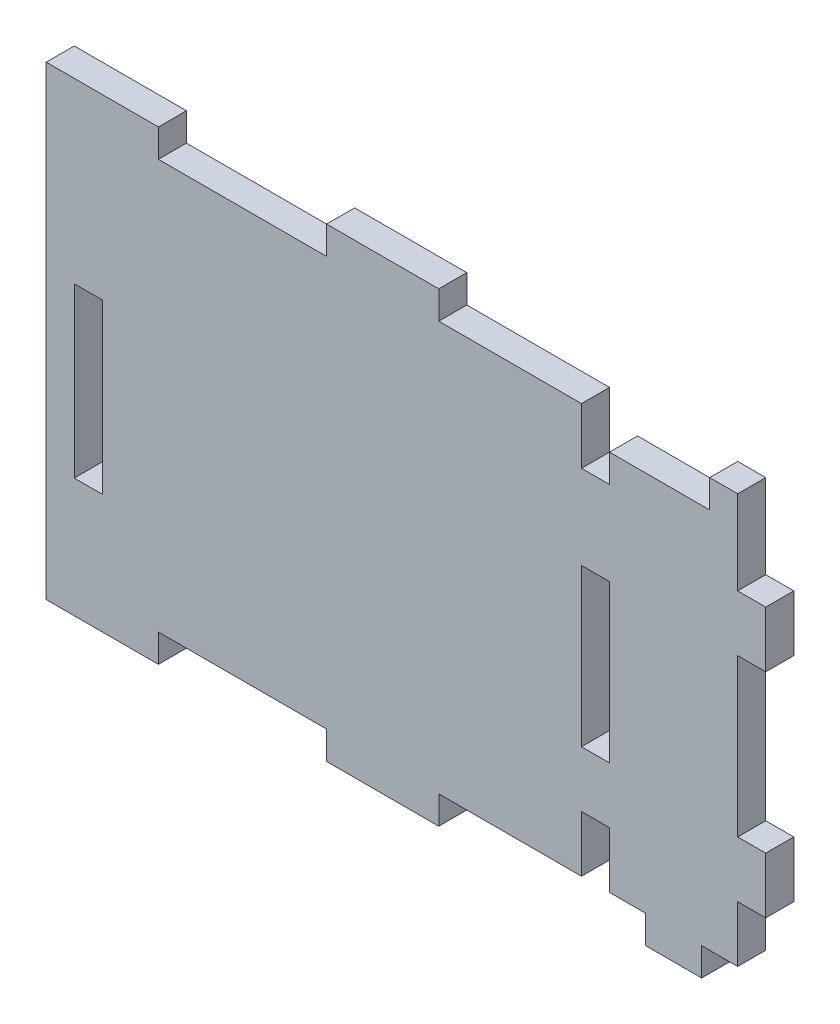
from build123d import *

# Parameters (mm, degrees)
ESQUISSE1_W             = 128.311788567
ESQUISSE1_H             = 73
BOSS_EXTRU_1_DEPTH      = 5
ESQUISSE3_W             = 5
ESQUISSE3_H             = 10
ESQUISSE3_H_2           = 28
ESQUISSE3_H_3           = 15
ESQUISSE3_H_4           = 30
ENL_V_MAT_EXTRU_1_DEPTH = 5
ESQUISSE4_W             = 17.86
ESQUISSE4_H             = 5
ENL_V_MAT_EXTRU_2_DEPTH = 5
ESQUISSE5_W             = 20
ESQUISSE5_H             = 5
ESQUISSE5_W_2           = 10
BOSS_EXTRU_2_DEPTH      = 5


with BuildPart() as part:
    # Esquisse1 → Boss.-Extru.1 (new body)
    with BuildSketch(Plane.XY):
        with Locations((-207.112987496, -6.063856407)):
            Rectangle(ESQUISSE1_W, ESQUISSE1_H)
    extrude(amount=BOSS_EXTRU_1_DEPTH)

    # Esquisse3 → Enlèv. mat.-Extru.1 (cut)
    with BuildSketch(Plane(origin=(0, 0, 0), x_dir=(-1, 0, 0), z_dir=(0, 0, -1))):
        with Locations((173.317093212, 25.436143593)):
            Rectangle(ESQUISSE3_W, ESQUISSE3_H)
        with Locations((173.317093212, -8.563856407)):
            Rectangle(ESQUISSE3_W, ESQUISSE3_H_2)
        with Locations((173.317093212, -37.563856407)):
            Rectangle(ESQUISSE3_W, ESQUISSE3_H)
        with Locations((145.457093212, 22.936143593)):
            Rectangle(ESQUISSE3_W, ESQUISSE3_H_3)
        with Locations((145.457093212, -8.563856407)):
            Rectangle(ESQUISSE3_W, ESQUISSE3_H_2)
        with Locations((145.457093212, -37.563856407)):
            Rectangle(ESQUISSE3_W, ESQUISSE3_H)
        with Locations((263.768881779, -11.288856407)):
            Rectangle(ESQUISSE3_W, ESQUISSE3_H_4)
    extrude(amount=-ENL_V_MAT_EXTRU_1_DEPTH, mode=Mode.SUBTRACT)

    # Esquisse4 → Enlèv. mat.-Extru.2 (cut)
    with BuildSketch(Plane.XY.offset(5)):
        with Locations((-161.887093212, 27.936143593)):
            Rectangle(ESQUISSE4_W, ESQUISSE4_H)
    extrude(amount=-ENL_V_MAT_EXTRU_2_DEPTH, mode=Mode.SUBTRACT)

    # Esquisse5 → Boss.-Extru.2 (add)
    with BuildSketch(Plane(origin=(0, 0, 0), x_dir=(-1, 0, 0), z_dir=(0, 0, -1))):
        with Locations((211.268881779, 32.936143593)):
            Rectangle(ESQUISSE5_W, ESQUISSE5_H)
        with Locations((261.268881779, 32.936143593)):
            Rectangle(ESQUISSE5_W, ESQUISSE5_H)
        with Locations((261.268881779, -45.063856407)):
            Rectangle(ESQUISSE5_W, ESQUISSE5_H)
        with Locations((211.268881779, -45.063856407)):
            Rectangle(ESQUISSE5_W, ESQUISSE5_H)
        with Locations((159.387093212, -45.063856407)):
            Rectangle(ESQUISSE5_W_2, ESQUISSE5_H)
    extrude(amount=-BOSS_EXTRU_2_DEPTH)


solid = part.part
